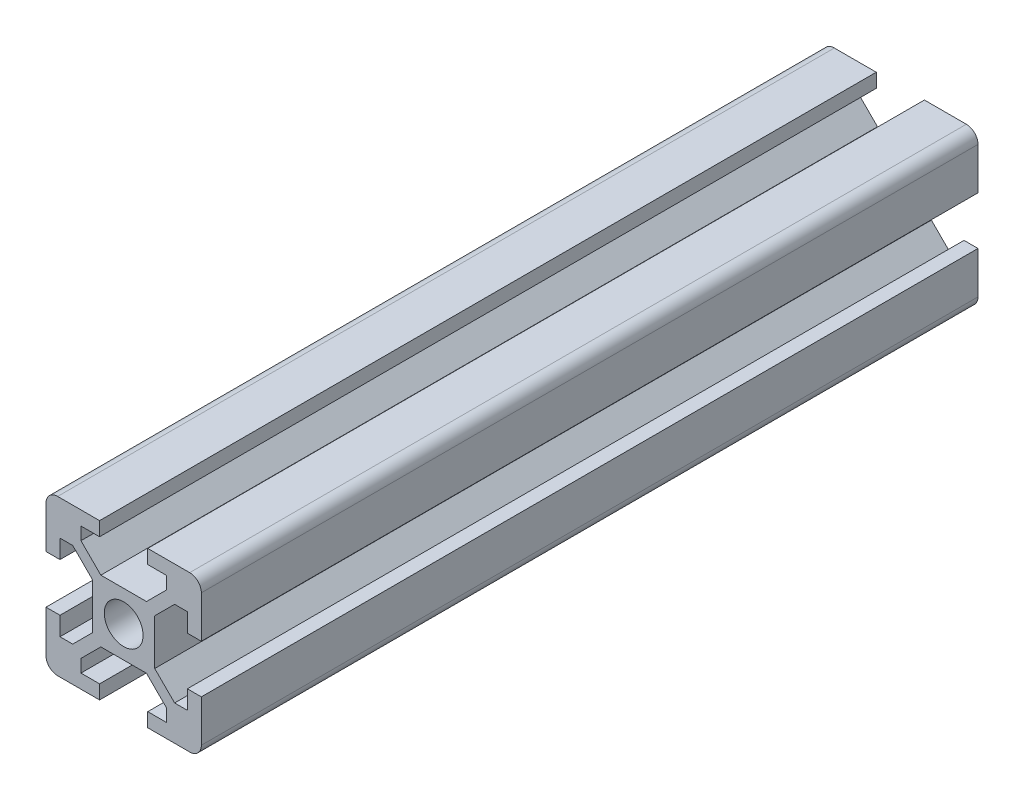
from build123d import *

# Parameters (mm, degrees)
SKETCH_1_R      = 2.5
EXTRUDE_2_DEPTH = 100


with BuildPart() as part:
    # 草图1 → 凸台-拉伸2 (new body)
    with BuildSketch(Plane.XY):
        with BuildLine():
            Line((5.5, -8.2), (5.5, -6.560660172))
            Line((5.5, -6.560660172), (2.939339828, -4))
            Line((2.939339828, -4), (-2.939339828, -4))
            Line((-2.939339828, -4), (-5.5, -6.560660172))
            Line((-5.5, -6.560660172), (-5.5, -8.2))
            Line((-5.5, -8.2), (-3.1, -8.2))
            Line((-3.1, -8.2), (-3.1, -10))
            Line((-3.1, -10), (-8.5, -10))
            ThreePointArc((-8.5, -10), (-9.560660172, -9.560660172), (-10, -8.5))
            Line((-10, -8.5), (-10, -3.1))
            Line((-10, -3.1), (-8.2, -3.1))
            Line((-8.2, -3.1), (-8.2, -5.5))
            Line((-8.2, -5.5), (-6.560660172, -5.5))
            Line((-6.560660172, -5.5), (-4, -2.939339828))
            Line((-4, -2.939339828), (-4, 2.939339828))
            Line((-4, 2.939339828), (-6.560660172, 5.5))
            Line((-6.560660172, 5.5), (-8.2, 5.5))
            Line((-8.2, 5.5), (-8.2, 3.1))
            Line((-8.2, 3.1), (-10, 3.1))
            Line((-10, 3.1), (-10, 8.5))
            ThreePointArc((-10, 8.5), (-9.560660172, 9.560660172), (-8.5, 10))
            Line((-8.5, 10), (-3.1, 10))
            Line((-3.1, 10), (-3.1, 8.2))
            Line((-3.1, 8.2), (-5.5, 8.2))
            Line((-5.5, 8.2), (-5.5, 6.560660172))
            Line((-5.5, 6.560660172), (-2.939339828, 4))
            Line((-2.939339828, 4), (2.939339828, 4))
            Line((2.939339828, 4), (5.5, 6.560660172))
            Line((5.5, 6.560660172), (5.5, 8.2))
            Line((5.5, 8.2), (3.1, 8.2))
            Line((3.1, 8.2), (3.1, 10))
            Line((3.1, 10), (8.5, 10))
            ThreePointArc((8.5, 10), (9.560660172, 9.560660172), (10, 8.5))
            Line((10, 8.5), (10, 3.1))
            Line((10, 3.1), (8.2, 3.1))
            Line((8.2, 3.1), (8.2, 5.5))
            Line((8.2, 5.5), (6.560660172, 5.5))
            Line((6.560660172, 5.5), (4, 2.939339828))
            Line((4, 2.939339828), (4, -2.939339828))
            Line((4, -2.939339828), (6.560660172, -5.5))
            Line((6.560660172, -5.5), (8.2, -5.5))
            Line((8.2, -5.5), (8.2, -3.1))
            Line((8.2, -3.1), (10, -3.1))
            Line((10, -3.1), (10, -8.5))
            ThreePointArc((10, -8.5), (9.560660172, -9.560660172), (8.5, -10))
            Line((8.5, -10), (3.1, -10))
            Line((3.1, -10), (3.1, -8.2))
            Line((3.1, -8.2), (5.5, -8.2))
        make_face()
        Circle(SKETCH_1_R, mode=Mode.SUBTRACT)
    extrude(amount=-EXTRUDE_2_DEPTH)


solid = part.part
